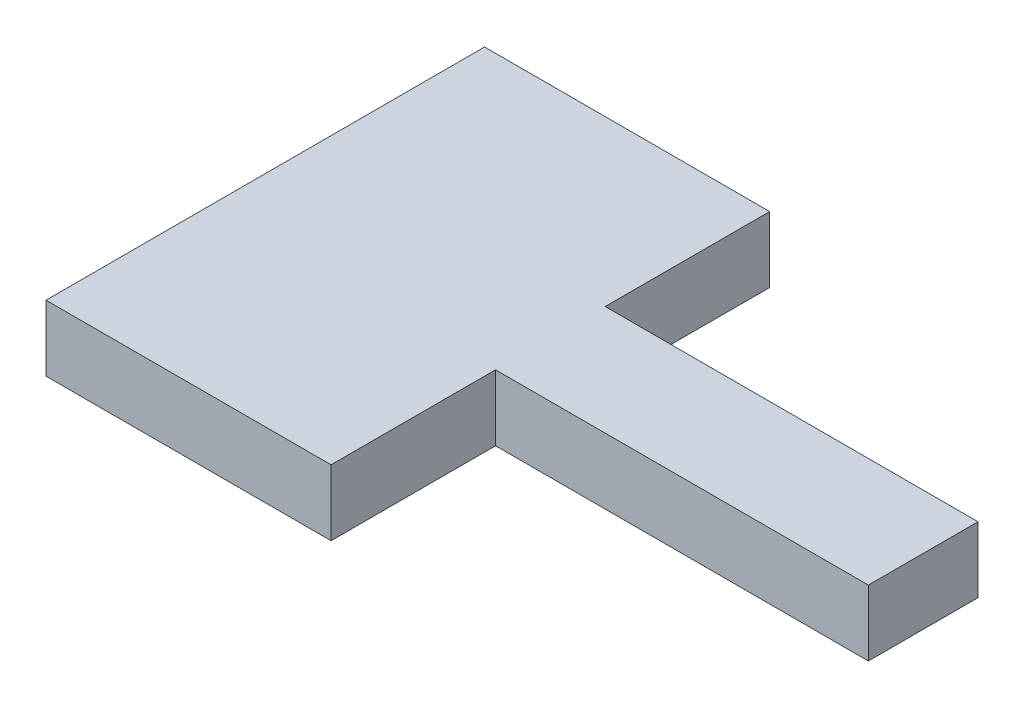
from build123d import *

# Parameters (mm, degrees)
BOSS_EXTRUDE1_DEPTH = 3


with BuildPart() as part:
    # Sketch1 → Boss-Extrude1 (new body)
    with BuildSketch(Plane(origin=(0, 0, 0), x_dir=(1, 0, 0), z_dir=(0, 1, 0))):
        Polygon((6.5, -10), (-6.5, -10), (-6.5, 10), (6.5, 10), (6.5, 2.5), (23.5, 2.5), (23.5, -2.5), (6.5, -2.5), align=None)
    extrude(amount=BOSS_EXTRUDE1_DEPTH)


solid = part.part
